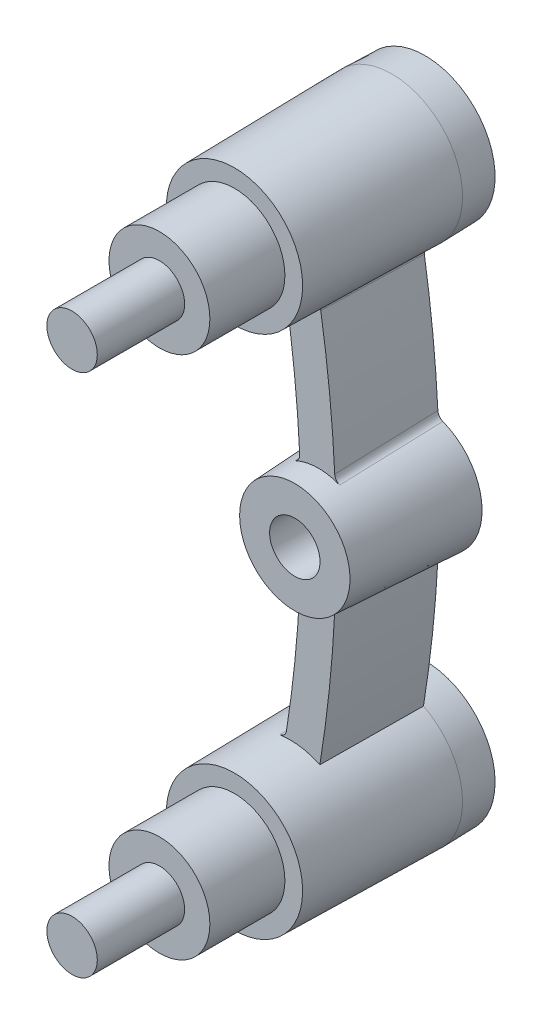
from build123d import *

# Parameters (mm, degrees)
SKETCH1_R                     = 4.5
BOSS_EXTRUDE1_DEPTH           = 12
BOSS_EXTRUDE1_DRAFT           = 1.0000000000000022
SKETCH1_R_2                   = 4.499999999999999
BOSS_EXTRUDE1_PROFILE_2_DEPTH = 12
BOSS_EXTRUDE1_PROFILE_2_DRAFT = 1.0000000000000022
EXTRUDE_THIN1_DEPTH           = 8.5
EXTRUDE_THIN1_TAPER           = 1.0000000000000022
SKETCH3_R                     = 3.1749999999999994
SKETCH3_R_2                   = 3.1750000000000003
BOSS_EXTRUDE2_DEPTH           = 4.72352
SKETCH4_R                     = 1.5874999999999995
BOSS_EXTRUDE3_DEPTH           = 5.5
SKETCH5_R                     = 4
BOSS_EXTRUDE4_DEPTH           = 10
BOSS_EXTRUDE4_DRAFT           = -3.0000000000000067
SKETCH6_R                     = 1.5875
CUT_EXTRUDE2_DEPTH            = 32.12113183273385
SKETCH8_W                     = 24.293621173691676
SKETCH8_H                     = 48.57680419756447
CUT_EXTRUDE3_DEPTH            = 2.1016
CUT_EXTRUDE3_DRAFT            = -3.0000000000000067
FILLET3_R                     = 0.5
BOSS_EXTRUDE5_DEPTH           = 2.1016
BOSS_EXTRUDE5_DRAFT           = 1.5000000000000033
BOSS_EXTRUDE5_PROFILE_2_DEPTH = 2.1016
BOSS_EXTRUDE5_PROFILE_2_DRAFT = 1.5000000000000033


with BuildPart() as part:
    # Sketch1 → Boss-Extrude1 (with draft: the straight prism first)
    with BuildSketch(Plane.XY):
        with Locations((4.16e-15, -16.5)):
            Circle(SKETCH1_R)
    extrude(amount=BOSS_EXTRUDE1_DEPTH)
    # Boss-Extrude1: the draft: its side faces are tilted about the plane it starts from
    boss_extrude1_sides = [part.faces().sort_by_distance(p)[0] for p in [
        (-4.5, -16.5, 6),
    ]]
    draft(boss_extrude1_sides, Plane.XY, BOSS_EXTRUDE1_DRAFT)



with BuildPart() as body_2:
    # Sketch1 → Boss-Extrude1 profile 2 (with draft: the straight prism first)
    with BuildSketch(Plane.XY):
        with Locations((2.14e-15, 16.5)):
            Circle(SKETCH1_R_2)
    extrude(amount=BOSS_EXTRUDE1_PROFILE_2_DEPTH)
    # Boss-Extrude1 profile 2: the draft: its side faces are tilted about the plane it starts from
    boss_extrude1_profile_2_sides = [body_2.faces().sort_by_distance(p)[0] for p in [
        (-4.5, 16.5, 6),
    ]]
    draft(boss_extrude1_profile_2_sides, Plane.XY, BOSS_EXTRUDE1_PROFILE_2_DRAFT)


with BuildPart() as part_1:
    add(part.part)

    add(body_2.part)  # Extrude-Thin1 merges body 2
    # Sketch2 → Extrude-Thin1 (add)
    with BuildSketch(Plane.XY):
        with BuildLine():
            ThreePointArc((-1.2205978438418867, 16.23048023521725), (0.5499999999999972, -1.65e-15), (-1.2205978438418867, -16.23048023521725))
            Line((-1.2205978438418867, -16.23048023521725), (1.2205978438418725, -16.76951976478275))
            ThreePointArc((1.2205978438418725, -16.76951976478275), (3.049999999999997, -1.55e-15), (1.2205978438418725, 16.76951976478275))
            Line((1.2205978438418725, 16.76951976478275), (-1.2205978438418867, 16.23048023521725))
        make_face()
    extrude(amount=EXTRUDE_THIN1_DEPTH, taper=EXTRUDE_THIN1_TAPER)

    # Sketch3 → Boss-Extrude2 (add)
    with BuildSketch(Plane.XY.offset(12)):
        with Locations((2.14e-15, 16.5)):
            Circle(SKETCH3_R)
        with Locations((4.16e-15, -16.5)):
            Circle(SKETCH3_R_2)
    extrude(amount=BOSS_EXTRUDE2_DEPTH)

    # Sketch4 → Boss-Extrude3 (add)
    with BuildSketch(Plane.XY.offset(16.723519999999997)):
        with Locations((2.14e-15, 16.5)):
            Circle(SKETCH4_R)
        with Locations((4.16e-15, -16.5)):
            Circle(SKETCH4_R)
    extrude(amount=BOSS_EXTRUDE3_DEPTH)


with BuildPart() as boss_extrude4_tool:
    # Sketch5 → Boss-Extrude4 (with draft: the straight prism first)
    with BuildSketch(Plane(origin=(0, 0, 0), x_dir=(-1, 0, 0), z_dir=(0, 0, -1))):
        with Locations((-1.800000000000003, 4.8e-15)):
            Circle(SKETCH5_R)
    extrude(amount=-BOSS_EXTRUDE4_DEPTH)
    # Boss-Extrude4: the draft: its side faces are tilted about the plane it starts from
    boss_extrude4_sides = [boss_extrude4_tool.faces().sort_by_distance(p)[0] for p in [
        (5.8, 0, 5),
    ]]
    draft(boss_extrude4_sides, Plane(origin=(0, 0, 0), x_dir=(-1, 0, 0), z_dir=(0, 0, -1)), BOSS_EXTRUDE4_DRAFT)


with BuildPart() as part_2:
    add(part_1.part)

    # Boss-Extrude4: add boss_extrude4_tool
    add(boss_extrude4_tool.part)

    # Sketch6 → Cut-Extrude2 (cut, through all)
    with BuildSketch(Plane(origin=(0, 0, 0), x_dir=(-1, 0, 0), z_dir=(0, 0, -1))):
        with Locations((-1.800000000000003, 4.8e-15)):
            Circle(SKETCH6_R)
    extrude(amount=-CUT_EXTRUDE2_DEPTH, mode=Mode.SUBTRACT)


with BuildPart() as cut_extrude3_tool:
    # Sketch8 → Cut-Extrude3 (with draft: the straight prism first)
    with BuildSketch(Plane(origin=(0, 0, 0), x_dir=(-1, 0, 0), z_dir=(0, 0, -1))):
        with Locations((-1.8000000000000034, 3.55e-15)):
            Rectangle(SKETCH8_W, SKETCH8_H)
    extrude(amount=-CUT_EXTRUDE3_DEPTH)
    # Cut-Extrude3: the draft: its side faces are tilted about the plane it starts from
    cut_extrude3_sides = [cut_extrude3_tool.faces().sort_by_distance(p)[0] for p in [
        (-10.346810587, 0, 1.0508),
        (1.8, 24.288402099, 1.0508),
        (13.946810587, 0, 1.0508),
        (1.8, -24.288402099, 1.0508),
    ]]
    draft(cut_extrude3_sides, Plane(origin=(0, 0, 0), x_dir=(-1, 0, 0), z_dir=(0, 0, -1)), CUT_EXTRUDE3_DRAFT)


with BuildPart() as part_3:
    add(part_2.part)

    # Cut-Extrude3: cut by cut_extrude3_tool
    add(cut_extrude3_tool.part, mode=Mode.SUBTRACT)

    # Fillet3
    fillet3_edges = [part_3.edges().sort_by_distance(p)[0] for p in [
        (2.875703510036772, -3.5633707778121826, 5.300800004583946),
        (0.56075512640978, -3.509846362379103, 5.3007999979967995),
        (0.5607551264097789, 3.509846362379112, 5.3007999979968),
        (2.8757035100367663, 3.5633707778121946, 5.300800004583947),
        (1.9383793782979752, 12.541652654109072, 5.300802791292249),
        (-0.3359925844562536, -12.105351289392495, 5.30080291178724),
    ]]
    fillet(fillet3_edges, radius=FILLET3_R)


with BuildPart() as boss_extrude5_tool:
    # Sketch9 → Boss-Extrude5 (with draft: the straight prism first)
    with BuildSketch(Plane(origin=(0, 0, 2.1016), x_dir=(-1, 0, 0), z_dir=(0, 0, -1))):
        with BuildLine():
            ThreePointArc((0.38410247709037837, 12.053241754838067), (1.0030223796907343, 20.849153907332106), (-2.2927893063262665, 12.670599159056522))
            ThreePointArc((-2.2927893063262665, 12.670599159056522), (-1.0030223796907416, 12.150846092667884), (0.38410247709037837, 12.053241754838067))
        make_face()
    extrude(amount=BOSS_EXTRUDE5_DEPTH)
    # Boss-Extrude5: the draft: its side faces are tilted about the plane it starts from
    boss_extrude5_sides = [boss_extrude5_tool.faces().sort_by_distance(p)[0] for p in [
        (-2.292789306, 20.329400841, 1.0508),
    ]]
    draft(boss_extrude5_sides, Plane(origin=(0, 0, 2.1016), x_dir=(-1, 0, 0), z_dir=(0, 0, -1)), BOSS_EXTRUDE5_DRAFT)


with BuildPart() as part_4:
    add(part_3.part)

    # Boss-Extrude5: add boss_extrude5_tool
    add(boss_extrude5_tool.part)


with BuildPart() as boss_extrude5_profile_2_tool:
    # Sketch9 → Boss-Extrude5 profile 2 (with draft: the straight prism first)
    with BuildSketch(Plane(origin=(0, 0, 2.1016), x_dir=(-1, 0, 0), z_dir=(0, 0, -1))):
        with BuildLine():
            ThreePointArc((-2.0001418504611626, -12.50993406296882), (0.6646601190590322, -20.91354965191909), (0.736311064528542, -12.097836938495403))
            ThreePointArc((0.736311064528542, -12.097836938495403), (-0.664660119059043, -12.08645034808091), (-2.0001418504611626, -12.50993406296882))
        make_face()
    extrude(amount=BOSS_EXTRUDE5_PROFILE_2_DEPTH)
    # Boss-Extrude5 profile 2: the draft: its side faces are tilted about the plane it starts from
    boss_extrude5_profile_2_sides = [boss_extrude5_profile_2_tool.faces().sort_by_distance(p)[0] for p in [
        (0.736311065, -20.902163062, 1.0508),
    ]]
    draft(boss_extrude5_profile_2_sides, Plane(origin=(0, 0, 2.1016), x_dir=(-1, 0, 0), z_dir=(0, 0, -1)), BOSS_EXTRUDE5_PROFILE_2_DRAFT)


with BuildPart() as part_5:
    add(part_4.part)

    # Boss-Extrude5 profile 2: add boss_extrude5_profile_2_tool
    add(boss_extrude5_profile_2_tool.part)


solid = part_5.part
